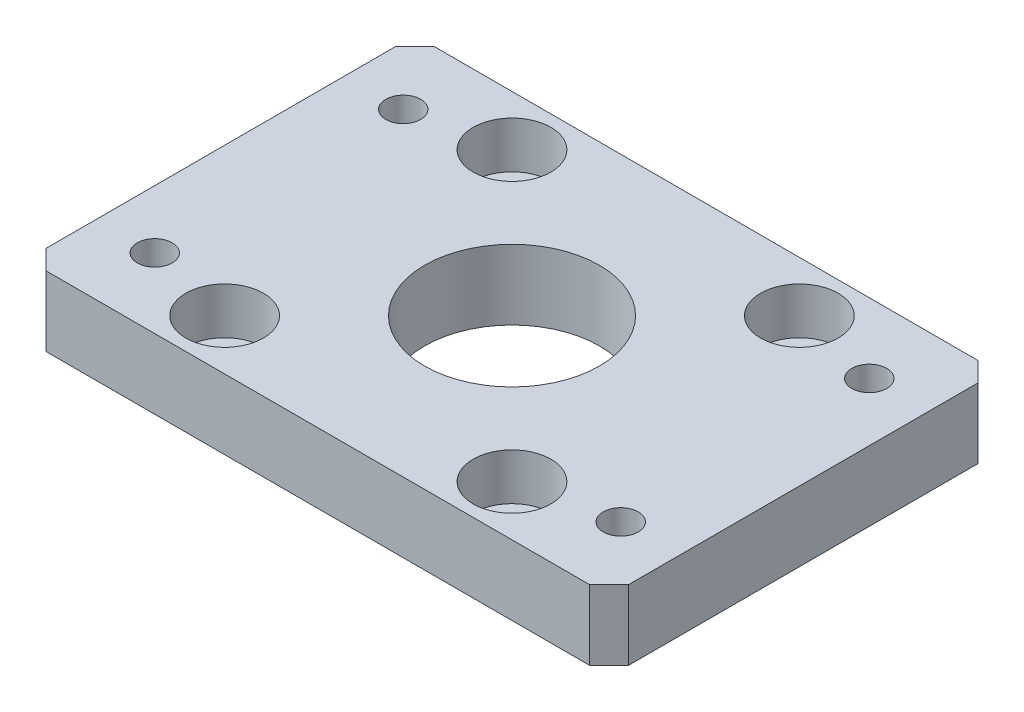
from build123d import *

# Parameters (mm, degrees)
SKETCH_1_W                    = 150
SKETCH_1_H                    = 100
EXTRUDE_1_DEPTH               = 18
CHAMFER_1_SIZE                = 5
HOLE_WIZARD_M8_1_D            = 9
HOLE_WIZARD_M8_1_CBORE_D      = 15
HOLE_WIZARD_M8_1_CBORE_DEPTH  = 8
HOLE_WIZARD_M12_5_D           = 13.5
HOLE_WIZARD_M12_5_CBORE_D     = 20
HOLE_WIZARD_M12_5_CBORE_DEPTH = 12
SKETCH_16_R                   = 22.5
CUT_EXTRUDE_3_DEPTH           = 92.91844211


with BuildPart() as part:
    # 草圖1 → 伸長1 (new body)
    with BuildSketch(Plane(origin=(0, 0, 0), x_dir=(1, 0, 0), z_dir=(0, 1, 0))):
        Rectangle(SKETCH_1_W, SKETCH_1_H)
    extrude(amount=EXTRUDE_1_DEPTH)

    # 導角1
    chamfer_1_edges = [part.edges().sort_by_distance(p)[0] for p in [
        (-75, 9, -50),
        (75, 9, -50),
        (75, 9, 50),
        (-75, 9, 50),
    ]]
    chamfer(chamfer_1_edges, length=CHAMFER_1_SIZE)

    # M8 六角承窩頭蓋螺釘的柱孔1 (through all)
    with Locations(Plane(origin=(-62.5, 0, 50), x_dir=(1, 0, 0), z_dir=(0, -1, 0))):
        with Locations((2.5, -82), (2.5, -18), (122.5, -18), (122.5, -82)):
            CounterBoreHole(HOLE_WIZARD_M8_1_D / 2, HOLE_WIZARD_M8_1_CBORE_D / 2, HOLE_WIZARD_M8_1_CBORE_DEPTH)

    # M12 六角承窩頭蓋螺釘的柱孔5 (through all)
    with Locations(Plane(origin=(0, 18, 0), x_dir=(-1, 0, 0), z_dir=(0, 1, 0))):
        with Locations((37, -37), (-37, -37), (-37, 37), (37, 37)):
            CounterBoreHole(HOLE_WIZARD_M12_5_D / 2, HOLE_WIZARD_M12_5_CBORE_D / 2, HOLE_WIZARD_M12_5_CBORE_DEPTH)

    # 草圖16 → 除料-伸長3 (cut, through all)
    with BuildSketch(Plane(origin=(0, 18, 0), x_dir=(1, 0, 0), z_dir=(0, 1, 0))):
        with Locations(Location((0, 0, 0), (0, 0, 270))):
            Circle(SKETCH_16_R)
    extrude(amount=-CUT_EXTRUDE_3_DEPTH, mode=Mode.SUBTRACT)


solid = part.part
